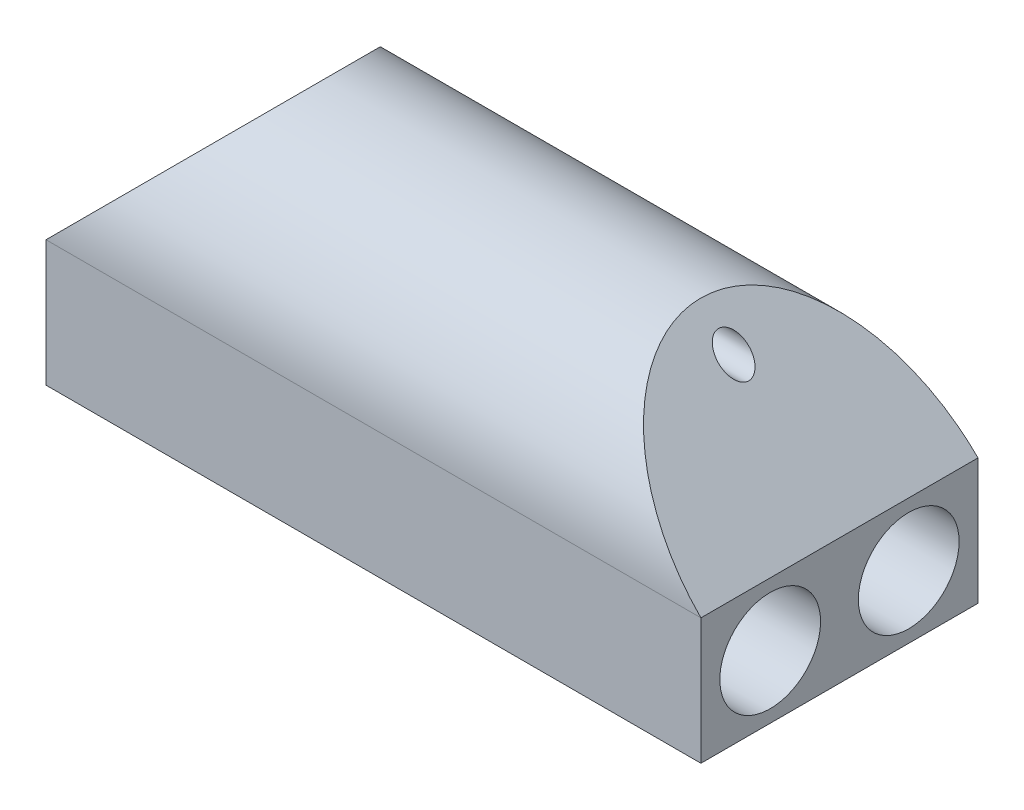
from build123d import *

# Parameters (mm, degrees)
SKETCH1_W              = 33.02
SKETCH1_H              = 13.97
DEPTH_A_DEPTH          = 6.35
ROUND_EXTRUDE_DEPTH    = 33.02
ANGLE_CUT_DEPTH        = 39.253150524
STRING_HOLE_R          = 0.762
STRING_HOLE_CUT_DEPTH  = 39.253150524
ELASTIC_HOLES_R        = 2.54
ELASTIC_HOLE_CUT_DEPTH = 39.253150524
GUIDE_CUT_REACH        = 40.253


with BuildPart() as part:
    # Sketch1 → depth a (new body)
    with BuildSketch(Plane(origin=(0, 0, 0), x_dir=(1, 0, 0), z_dir=(0, 1, 0))):
        with Locations((-16.51, 6.985)):
            Rectangle(SKETCH1_W, SKETCH1_H)
    extrude(amount=DEPTH_A_DEPTH)

    # Sketch4 → round extrude (add)
    with BuildSketch(Plane(origin=(0, 0, 0), x_dir=(0, 0, -1), z_dir=(1, 0, 0))):
        with BuildLine():
            Line((0, 6.35), (13.97, 6.35))
            ThreePointArc((13.97, 6.35), (6.985, 13.335), (0, 6.35))
        make_face()
    extrude(amount=-ROUND_EXTRUDE_DEPTH)

    # Sketch5 → angle cut (cut, through all)
    with BuildSketch(Plane.XY):
        Polygon((0, 6.35), (0, 13.335), (-6.985, 13.335), align=None)
        Polygon((-33.02, 6.35), (-33.02, 13.335), (-26.035, 13.335), align=None)
    extrude(amount=-ANGLE_CUT_DEPTH, mode=Mode.SUBTRACT)

    # string hole → string hole cut (cut, through all)
    with BuildSketch(Plane(origin=(0, 0, 0), x_dir=(0, 0, -1), z_dir=(1, 0, 0))):
        with Locations(Location((6.985, 11.684, 0), (0, 0, 270))):
            Circle(STRING_HOLE_R)
    extrude(amount=-STRING_HOLE_CUT_DEPTH, mode=Mode.SUBTRACT)

    # elastic holes → elastic hole cut (cut, through all)
    with BuildSketch(Plane(origin=(0, 0, 0), x_dir=(0, 0, -1), z_dir=(1, 0, 0))):
        with Locations((3.4925, 3.175)):
            Circle(ELASTIC_HOLES_R)
        with Locations(Location((10.4775, 3.175, 0), (0, 0, 180))):
            Circle(ELASTIC_HOLES_R)
    extrude(amount=-ELASTIC_HOLE_CUT_DEPTH, mode=Mode.SUBTRACT)

    # guide → guide cut (cut, up to next)
    with BuildSketch(Plane(origin=(0, 0, 0), x_dir=(1, 0, 0), z_dir=(0, 1, 0)), mode=Mode.PRIVATE) as guide_cut_sk1:
        with BuildLine():
            Line((-33.02, 13.97), (-33.02, 0))
            ThreePointArc((-33.02, 0), (-30.238033275, 6.985), (-33.02, 13.97))
        make_face()
    guide_cut_tool1 = extrude(guide_cut_sk1.sketch, amount=GUIDE_CUT_REACH, mode=Mode.PRIVATE) & part.part
    add(guide_cut_tool1.solids().sort_by_distance((-31.893025, 0, -6.985))[0], mode=Mode.SUBTRACT)


solid = part.part
